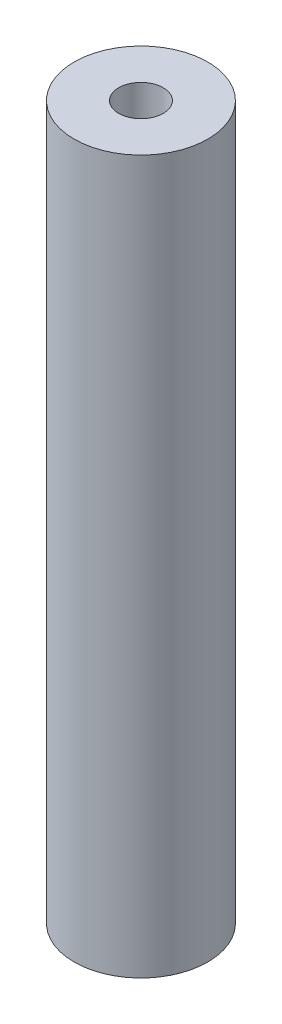
from build123d import *

# Parameters (mm, degrees)
SKETCH1_R           = 7.5
SKETCH1_R_2         = 2.5
BOSS_EXTRUDE1_DEPTH = 80


with BuildPart() as part:
    # Sketch1 → Boss-Extrude1 (new body)
    with BuildSketch(Plane(origin=(0, 0, 0), x_dir=(1, 0, 0), z_dir=(0, 1, 0))):
        with Locations(Location((0, 0, 0), (0, 0, 270))):
            Circle(SKETCH1_R)
        with Locations(Location((0, 0, 0), (0, 0, 270))):
            Circle(SKETCH1_R_2, mode=Mode.SUBTRACT)
    extrude(amount=BOSS_EXTRUDE1_DEPTH)


solid = part.part
